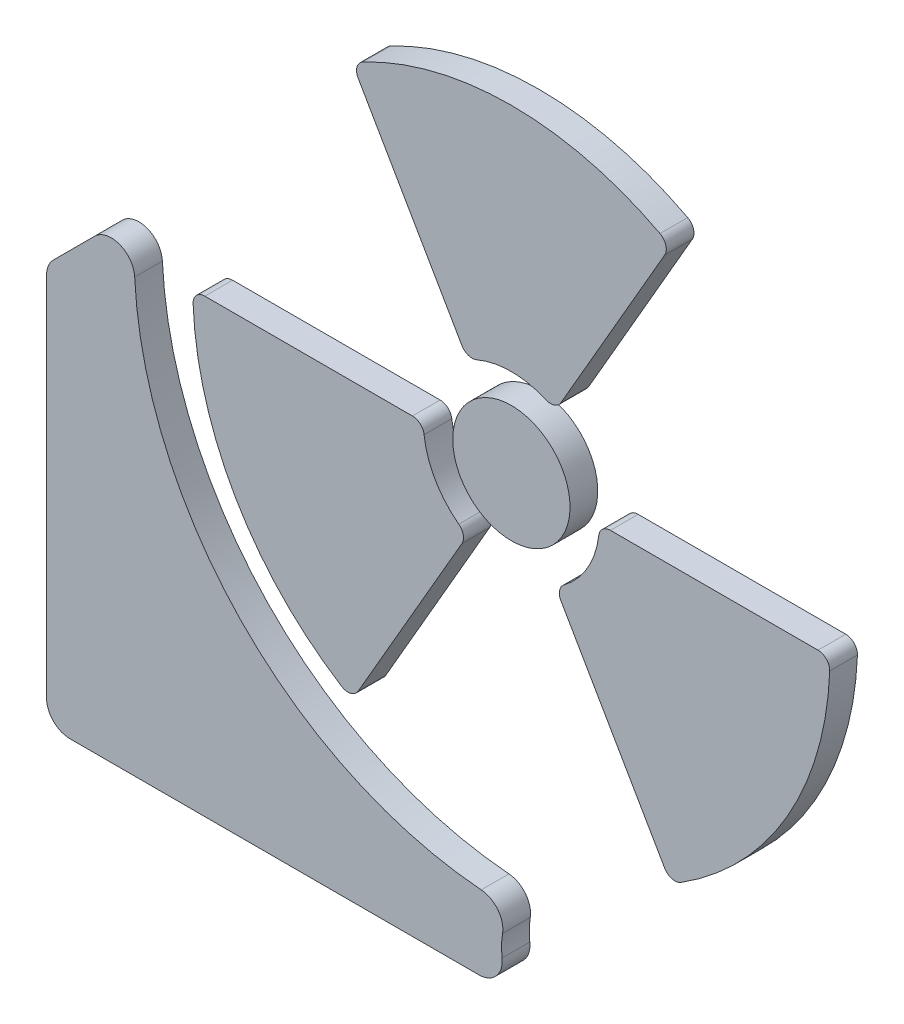
from build123d import *

# Parameters (mm, degrees)
SKETCH1_W           = 101.6
SKETCH1_H           = 101.6
BOSS_EXTRUDE1_DEPTH = 3
SKETCH3_W           = 101.6
SKETCH3_H           = 101.6
SKETCH3_R           = 6.35
CUT_EXTRUDE1_DEPTH  = 72.904659098


with BuildPart() as part:
    # Sketch1 → Boss-Extrude1 (new body)
    with BuildSketch(Plane.XY):
        Rectangle(SKETCH1_W, SKETCH1_H)
    extrude(amount=BOSS_EXTRUDE1_DEPTH)

    # Sketch3 → Cut-Extrude1 (cut, through all)
    with BuildSketch(Plane(origin=(0, 0, 0), x_dir=(-1, 0, 0), z_dir=(0, 0, -1))):
        Rectangle(SKETCH3_W, SKETCH3_H)
        with Locations((-9.952896715, 9.952896715)):
            Circle(SKETCH3_R, mode=Mode.SUBTRACT)
        with BuildLine():
            ThreePointArc((37.846, -38.862), (39.642051224, -38.118051224), (40.386, -36.322))
            Line((40.386, -36.322), (40.386, 3.353015566))
            ThreePointArc((40.386, 3.353015566), (40.192654013, 4.325031484), (39.642051224, 5.14906679))
            Line((39.642051224, 5.14906679), (35.177671526, 9.613446489))
            ThreePointArc((35.177671526, 9.613446489), (32.467667298, 10.18726655), (30.844698846, 7.942413376))
            ThreePointArc((30.844698846, 7.942413376), (19.371216203, -18.482683961), (-6.688461818, -30.76355342))
            ThreePointArc((-6.688461818, -30.76355342), (-8.481874265, -31.725089418), (-8.993918742, -33.694528459))
            ThreePointArc((-8.993918742, -33.694528459), (-8.888689559, -34.862242487), (-8.942533745, -36.033451281))
            ThreePointArc((-8.942533745, -36.033451281), (-8.314301808, -38.012959233), (-6.418976803, -38.862))
            Line((-6.418976803, -38.862), (37.846, -38.862))
        make_face(mode=Mode.SUBTRACT)
        with BuildLine():
            ThreePointArc((6.141160454, 40.465704827), (-9.952896715, 44.45), (-26.046953884, 40.465704827))
            ThreePointArc((-26.046953884, 40.465704827), (-26.67467501, 39.694473658), (-26.554308498, 38.7073854))
            Line((-26.554308498, 38.7073854), (-15.312913623, 19.236718328))
            ThreePointArc((-15.312913623, 19.236718328), (-14.613476332, 18.6664931), (-13.711865519, 18.704798139))
            ThreePointArc((-13.711865519, 18.704798139), (-9.952896715, 19.477896715), (-6.193927911, 18.704798139))
            ThreePointArc((-6.193927911, 18.704798139), (-5.292317098, 18.6664931), (-4.592879807, 19.236718328))
            Line((-4.592879807, 19.236718328), (6.648515068, 38.7073854))
            ThreePointArc((6.648515068, 38.7073854), (6.76888158, 39.694473658), (6.141160454, 40.465704827))
        make_face(mode=Mode.SUBTRACT)
        with BuildLine():
            ThreePointArc((-28.330735096, -19.2413697), (-27.348968749, -19.399376556), (-26.554308498, -18.80159197))
            Line((-26.554308498, -18.80159197), (-15.312913623, 0.669075101))
            ThreePointArc((-15.312913623, 0.669075101), (-15.168802735, 1.559918177), (-15.652781277, 2.321583527))
            ThreePointArc((-15.652781277, 2.321583527), (-18.201788686, 5.190396715), (-19.411750081, 8.83230848))
            ThreePointArc((-19.411750081, 8.83230848), (-19.829382352, 9.632278867), (-20.67293053, 9.952896715))
            Line((-20.67293053, 9.952896715), (-43.15572028, 9.952896715))
            ThreePointArc((-43.15572028, 9.952896715), (-44.070747044, 9.563593043), (-44.424792266, 8.634355017))
            ThreePointArc((-44.424792266, 8.634355017), (-39.828264517, -7.295654928), (-28.330735096, -19.2413697))
        make_face(mode=Mode.SUBTRACT)
        with BuildLine():
            ThreePointArc((-4.253012153, 2.321583527), (-4.736990695, 1.559918177), (-4.592879807, 0.669075101))
            Line((-4.592879807, 0.669075101), (6.648515068, -18.80159197))
            ThreePointArc((6.648515068, -18.80159197), (7.443175319, -19.399376556), (8.424941666, -19.2413697))
            ThreePointArc((8.424941666, -19.2413697), (19.922471087, -7.295654928), (24.518998836, 8.634355017))
            ThreePointArc((24.518998836, 8.634355017), (24.164953614, 9.563593043), (23.249926851, 9.952896715))
            Line((23.249926851, 9.952896715), (0.7671371, 9.952896715))
            ThreePointArc((0.7671371, 9.952896715), (-0.076411078, 9.632278867), (-0.494043349, 8.83230848))
            ThreePointArc((-0.494043349, 8.83230848), (-1.704004744, 5.190396715), (-4.253012153, 2.321583527))
        make_face(mode=Mode.SUBTRACT)
    extrude(amount=-CUT_EXTRUDE1_DEPTH, mode=Mode.SUBTRACT)


with BuildPart() as cut_extrude1_piece_1:
    # of the separate pieces the step leaves, piece 1, a body of its own (cut_extrude1_pieces)
    add(part.part.solids().sort_by_distance((6.688461818, -30.76355342, 0))[0])


with BuildPart() as cut_extrude1_piece_2:
    # of the separate pieces the step leaves, piece 2, a body of its own (cut_extrude1_pieces)
    add(part.part.solids().sort_by_distance((-0.7671371, 9.952896715, 0))[0])


with BuildPart() as cut_extrude1_piece_3:
    # of the separate pieces the step leaves, piece 3, a body of its own (cut_extrude1_pieces)
    add(part.part.solids().sort_by_distance((20.67293053, 9.952896715, 0))[0])


with BuildPart() as cut_extrude1_piece_4:
    # of the separate pieces the step leaves, piece 4, a body of its own (cut_extrude1_pieces)
    add(part.part.solids().sort_by_distance((4.592879807, 19.236718328, 0))[0])


with BuildPart() as cut_extrude1_piece_5:
    # of the separate pieces the step leaves, piece 5, a body of its own (cut_extrude1_pieces)
    add(part.part.solids().sort_by_distance((3.602896715, 9.952896715, 0))[0])


solid = Compound([cut_extrude1_piece_1.part, cut_extrude1_piece_2.part, cut_extrude1_piece_3.part, cut_extrude1_piece_4.part, cut_extrude1_piece_5.part])
